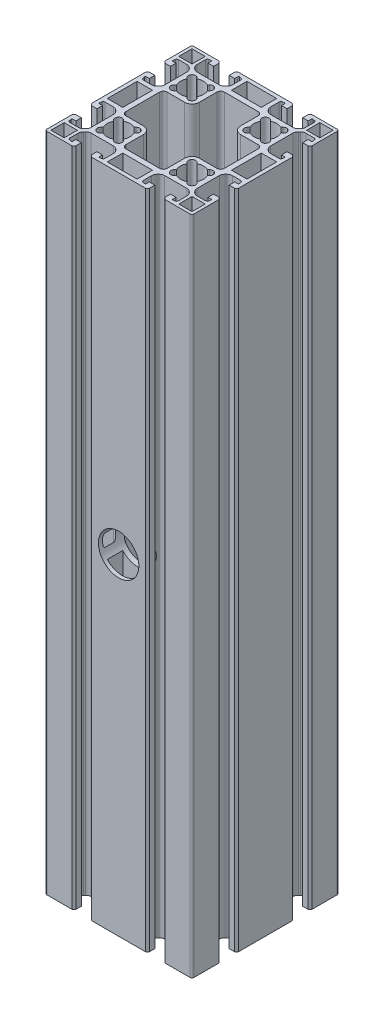
from build123d import *

# Parameters (mm, degrees)
SKETCH1_W           = 8.4
SKETCH1_H           = 16.2
SKETCH1_W_2         = 7.2
SKETCH1_H_2         = 7.2
SKETCH1_W_3         = 16.2
SKETCH1_H_3         = 8.4
BOSS_EXTRUDE1_DEPTH = 360
SKETCH3_R           = 11
CUT_EXTRUDE1_DEPTH  = 371.957573711


with BuildPart() as part:
    # Sketch1 → Boss-Extrude1 (new body)
    with BuildSketch(Plane(origin=(0, 0, 0), x_dir=(1, 0, 0), z_dir=(0, 1, 0))):
        with BuildLine():
            Line((39.881157874, -42.704615906), (39.881157874, -28.954615906))
            Line((39.881157874, -28.954615906), (38.881157874, -27.954615906))
            Line((38.881157874, -27.954615906), (35.881157874, -27.954615906))
            Line((35.881157874, -27.954615906), (35.881157874, -30.954615906))
            Line((35.881157874, -30.954615906), (37.485281077, -30.954615906))
            ThreePointArc((37.485281077, -30.954615906), (37.868303299, -31.133222101), (37.977684954, -31.541439995))
            Line((37.977684954, -31.541439995), (37.797926779, -32.560899266))
            ThreePointArc((37.797926779, -32.560899266), (37.49010865, -33.094055905), (36.911599801, -33.304615906))
            Line((36.911599801, -33.304615906), (32.215023493, -33.304615906))
            ThreePointArc((32.215023493, -33.304615906), (31.066973196, -33.076254504), (30.09370315, -32.42593625))
            Line((30.09370315, -32.42593625), (29.55983753, -31.89207063))
            ThreePointArc((29.55983753, -31.89207063), (28.909519276, -30.918800583), (28.681157874, -29.770750286))
            Line((28.681157874, -29.770750286), (28.681157874, -17.638481526))
            ThreePointArc((28.681157874, -17.638481526), (28.909519276, -16.490431229), (29.55983753, -15.517161182))
            Line((29.55983753, -15.517161182), (30.09370315, -14.983295562))
            ThreePointArc((30.09370315, -14.983295562), (31.066973196, -14.332977309), (32.215023493, -14.104615906))
            Line((32.215023493, -14.104615906), (36.911599801, -14.104615906))
            ThreePointArc((36.911599801, -14.104615906), (37.49010865, -14.315175907), (37.797926779, -14.848332546))
            Line((37.797926779, -14.848332546), (37.977684954, -15.867791817))
            ThreePointArc((37.977684954, -15.867791817), (37.868303299, -16.276009711), (37.485281077, -16.454615906))
            Line((37.485281077, -16.454615906), (35.881157874, -16.454615906))
            Line((35.881157874, -16.454615906), (35.881157874, -19.454615906))
            Line((35.881157874, -19.454615906), (38.881157874, -19.454615906))
            Line((38.881157874, -19.454615906), (39.881157874, -18.454615906))
            Line((39.881157874, -18.454615906), (39.881157874, 11.045384094))
            Line((39.881157874, 11.045384094), (38.881157874, 12.045384094))
            Line((38.881157874, 12.045384094), (35.881157874, 12.045384094))
            Line((35.881157874, 12.045384094), (35.881157874, 9.045384094))
            Line((35.881157874, 9.045384094), (37.485281077, 9.045384094))
            ThreePointArc((37.485281077, 9.045384094), (37.868303299, 8.866777899), (37.977684954, 8.458560005))
            Line((37.977684954, 8.458560005), (37.797926779, 7.439100734))
            ThreePointArc((37.797926779, 7.439100734), (37.49010865, 6.905944095), (36.911599801, 6.695384094))
            Line((36.911599801, 6.695384094), (32.215023493, 6.695384094))
            ThreePointArc((32.215023493, 6.695384094), (31.066973196, 6.923745496), (30.09370315, 7.57406375))
            Line((30.09370315, 7.57406375), (29.55983753, 8.10792937))
            ThreePointArc((29.55983753, 8.10792937), (28.909519276, 9.081199417), (28.681157874, 10.229249714))
            Line((28.681157874, 10.229249714), (28.681157874, 22.361518474))
            ThreePointArc((28.681157874, 22.361518474), (28.909519276, 23.509568771), (29.55983753, 24.482838818))
            Line((29.55983753, 24.482838818), (30.09370315, 25.016704438))
            ThreePointArc((30.09370315, 25.016704438), (31.066973196, 25.667022691), (32.215023493, 25.895384094))
            Line((32.215023493, 25.895384094), (36.911599801, 25.895384094))
            ThreePointArc((36.911599801, 25.895384094), (37.49010865, 25.684824093), (37.797926779, 25.151667454))
            Line((37.797926779, 25.151667454), (37.977684954, 24.132208183))
            ThreePointArc((37.977684954, 24.132208183), (37.868303299, 23.723990289), (37.485281077, 23.545384094))
            Line((37.485281077, 23.545384094), (35.881157874, 23.545384094))
            Line((35.881157874, 23.545384094), (35.881157874, 20.545384094))
            Line((35.881157874, 20.545384094), (38.881157874, 20.545384094))
            Line((38.881157874, 20.545384094), (39.881157874, 21.545384094))
            Line((39.881157874, 21.545384094), (39.881157874, 35.295384094))
            ThreePointArc((39.881157874, 35.295384094), (39.588264655, 36.002490875), (38.881157874, 36.295384094))
            Line((38.881157874, 36.295384094), (25.131157874, 36.295384094))
            Line((25.131157874, 36.295384094), (24.131157874, 35.295384094))
            Line((24.131157874, 35.295384094), (24.131157874, 32.295384094))
            Line((24.131157874, 32.295384094), (27.131157874, 32.295384094))
            Line((27.131157874, 32.295384094), (27.131157874, 33.899507298))
            ThreePointArc((27.131157874, 33.899507298), (27.309764069, 34.282529519), (27.717981962, 34.391911174))
            Line((27.717981962, 34.391911174), (28.737441233, 34.212152999))
            ThreePointArc((28.737441233, 34.212152999), (29.270597872, 33.90433487), (29.481157874, 33.325826021))
            Line((29.481157874, 33.325826021), (29.481157874, 28.629249714))
            ThreePointArc((29.481157874, 28.629249714), (29.252796471, 27.481199417), (28.602478217, 26.50792937))
            Line((28.602478217, 26.50792937), (28.068612597, 25.97406375))
            ThreePointArc((28.068612597, 25.97406375), (27.095342551, 25.323745496), (25.947292254, 25.095384094))
            Line((25.947292254, 25.095384094), (13.815023493, 25.095384094))
            ThreePointArc((13.815023493, 25.095384094), (12.666973196, 25.323745496), (11.69370315, 25.97406375))
            Line((11.69370315, 25.97406375), (11.15983753, 26.50792937))
            ThreePointArc((11.15983753, 26.50792937), (10.509519276, 27.481199417), (10.281157874, 28.629249714))
            Line((10.281157874, 28.629249714), (10.281157874, 33.325826021))
            ThreePointArc((10.281157874, 33.325826021), (10.491717875, 33.90433487), (11.024874514, 34.212152999))
            Line((11.024874514, 34.212152999), (12.044333785, 34.391911174))
            ThreePointArc((12.044333785, 34.391911174), (12.452551678, 34.282529519), (12.631157874, 33.899507298))
            Line((12.631157874, 33.899507298), (12.631157874, 32.295384094))
            Line((12.631157874, 32.295384094), (15.631157874, 32.295384094))
            Line((15.631157874, 32.295384094), (15.631157874, 35.295384094))
            Line((15.631157874, 35.295384094), (14.631157874, 36.295384094))
            Line((14.631157874, 36.295384094), (-14.868842126, 36.295384094))
            Line((-14.868842126, 36.295384094), (-15.868842126, 35.295384094))
            Line((-15.868842126, 35.295384094), (-15.868842126, 32.295384094))
            Line((-15.868842126, 32.295384094), (-12.868842126, 32.295384094))
            Line((-12.868842126, 32.295384094), (-12.868842126, 33.899507298))
            ThreePointArc((-12.868842126, 33.899507298), (-12.690235931, 34.282529519), (-12.282018038, 34.391911174))
            Line((-12.282018038, 34.391911174), (-11.262558767, 34.212152999))
            ThreePointArc((-11.262558767, 34.212152999), (-10.729402128, 33.90433487), (-10.518842126, 33.325826021))
            Line((-10.518842126, 33.325826021), (-10.518842126, 28.629249714))
            ThreePointArc((-10.518842126, 28.629249714), (-10.747203529, 27.481199417), (-11.397521783, 26.50792937))
            Line((-11.397521783, 26.50792937), (-11.931387403, 25.97406375))
            ThreePointArc((-11.931387403, 25.97406375), (-12.904657449, 25.323745496), (-14.052707746, 25.095384094))
            Line((-14.052707746, 25.095384094), (-26.184976507, 25.095384094))
            ThreePointArc((-26.184976507, 25.095384094), (-27.333026804, 25.323745496), (-28.30629685, 25.97406375))
            Line((-28.30629685, 25.97406375), (-28.84016247, 26.50792937))
            ThreePointArc((-28.84016247, 26.50792937), (-29.490480724, 27.481199417), (-29.718842126, 28.629249714))
            Line((-29.718842126, 28.629249714), (-29.718842126, 33.325826021))
            ThreePointArc((-29.718842126, 33.325826021), (-29.508282125, 33.90433487), (-28.975125486, 34.212152999))
            Line((-28.975125486, 34.212152999), (-27.955666215, 34.391911174))
            ThreePointArc((-27.955666215, 34.391911174), (-27.547448322, 34.282529519), (-27.368842126, 33.899507298))
            Line((-27.368842126, 33.899507298), (-27.368842126, 32.295384094))
            Line((-27.368842126, 32.295384094), (-24.368842126, 32.295384094))
            Line((-24.368842126, 32.295384094), (-24.368842126, 35.295384094))
            Line((-24.368842126, 35.295384094), (-25.368842126, 36.295384094))
            Line((-25.368842126, 36.295384094), (-39.118842126, 36.295384094))
            ThreePointArc((-39.118842126, 36.295384094), (-39.825948908, 36.002490875), (-40.118842126, 35.295384094))
            Line((-40.118842126, 35.295384094), (-40.118842126, 21.545384094))
            Line((-40.118842126, 21.545384094), (-39.118842126, 20.545384094))
            Line((-39.118842126, 20.545384094), (-36.118842126, 20.545384094))
            Line((-36.118842126, 20.545384094), (-36.118842126, 23.545384094))
            Line((-36.118842126, 23.545384094), (-37.72296533, 23.545384094))
            ThreePointArc((-37.72296533, 23.545384094), (-38.105987552, 23.723990289), (-38.215369207, 24.132208183))
            Line((-38.215369207, 24.132208183), (-38.035611031, 25.151667454))
            ThreePointArc((-38.035611031, 25.151667454), (-37.727792902, 25.684824093), (-37.149284054, 25.895384094))
            Line((-37.149284054, 25.895384094), (-32.452707746, 25.895384094))
            ThreePointArc((-32.452707746, 25.895384094), (-31.304657449, 25.667022691), (-30.331387403, 25.016704438))
            Line((-30.331387403, 25.016704438), (-29.797521783, 24.482838818))
            ThreePointArc((-29.797521783, 24.482838818), (-29.147203529, 23.509568771), (-28.918842126, 22.361518474))
            Line((-28.918842126, 22.361518474), (-28.918842126, 10.229249714))
            ThreePointArc((-28.918842126, 10.229249714), (-29.147203529, 9.081199417), (-29.797521783, 8.10792937))
            Line((-29.797521783, 8.10792937), (-30.331387403, 7.57406375))
            ThreePointArc((-30.331387403, 7.57406375), (-31.304657449, 6.923745496), (-32.452707746, 6.695384094))
            Line((-32.452707746, 6.695384094), (-37.149284054, 6.695384094))
            ThreePointArc((-37.149284054, 6.695384094), (-37.727792902, 6.905944095), (-38.035611031, 7.439100734))
            Line((-38.035611031, 7.439100734), (-38.215369207, 8.458560005))
            ThreePointArc((-38.215369207, 8.458560005), (-38.105987552, 8.866777899), (-37.72296533, 9.045384094))
            Line((-37.72296533, 9.045384094), (-36.118842126, 9.045384094))
            Line((-36.118842126, 9.045384094), (-36.118842126, 12.045384094))
            Line((-36.118842126, 12.045384094), (-39.118842126, 12.045384094))
            Line((-39.118842126, 12.045384094), (-40.118842126, 11.045384094))
            Line((-40.118842126, 11.045384094), (-40.118842126, -18.454615906))
            Line((-40.118842126, -18.454615906), (-39.118842126, -19.454615906))
            Line((-39.118842126, -19.454615906), (-36.118842126, -19.454615906))
            Line((-36.118842126, -19.454615906), (-36.118842126, -16.454615906))
            Line((-36.118842126, -16.454615906), (-37.72296533, -16.454615906))
            ThreePointArc((-37.72296533, -16.454615906), (-38.105987552, -16.276009711), (-38.215369207, -15.867791817))
            Line((-38.215369207, -15.867791817), (-38.035611031, -14.848332546))
            ThreePointArc((-38.035611031, -14.848332546), (-37.727792902, -14.315175907), (-37.149284054, -14.104615906))
            Line((-37.149284054, -14.104615906), (-32.452707746, -14.104615906))
            ThreePointArc((-32.452707746, -14.104615906), (-31.304657449, -14.332977309), (-30.331387403, -14.983295562))
            Line((-30.331387403, -14.983295562), (-29.797521783, -15.517161182))
            ThreePointArc((-29.797521783, -15.517161182), (-29.147203529, -16.490431229), (-28.918842126, -17.638481526))
            Line((-28.918842126, -17.638481526), (-28.918842126, -29.770750286))
            ThreePointArc((-28.918842126, -29.770750286), (-29.147203529, -30.918800583), (-29.797521783, -31.89207063))
            Line((-29.797521783, -31.89207063), (-30.331387403, -32.42593625))
            ThreePointArc((-30.331387403, -32.42593625), (-31.304657449, -33.076254504), (-32.452707746, -33.304615906))
            Line((-32.452707746, -33.304615906), (-37.149284054, -33.304615906))
            ThreePointArc((-37.149284054, -33.304615906), (-37.727792902, -33.094055905), (-38.035611031, -32.560899266))
            Line((-38.035611031, -32.560899266), (-38.215369207, -31.541439995))
            ThreePointArc((-38.215369207, -31.541439995), (-38.105987552, -31.133222101), (-37.72296533, -30.954615906))
            Line((-37.72296533, -30.954615906), (-36.118842126, -30.954615906))
            Line((-36.118842126, -30.954615906), (-36.118842126, -27.954615906))
            Line((-36.118842126, -27.954615906), (-39.118842126, -27.954615906))
            Line((-39.118842126, -27.954615906), (-40.118842126, -28.954615906))
            Line((-40.118842126, -28.954615906), (-40.118842126, -42.704615906))
            ThreePointArc((-40.118842126, -42.704615906), (-39.825948908, -43.411722687), (-39.118842126, -43.704615906))
            Line((-39.118842126, -43.704615906), (-25.368842126, -43.704615906))
            Line((-25.368842126, -43.704615906), (-24.368842126, -42.704615906))
            Line((-24.368842126, -42.704615906), (-24.368842126, -39.704615906))
            Line((-24.368842126, -39.704615906), (-27.368842126, -39.704615906))
            Line((-27.368842126, -39.704615906), (-27.368842126, -41.30873911))
            ThreePointArc((-27.368842126, -41.30873911), (-27.547448322, -41.691761331), (-27.955666215, -41.801142986))
            Line((-27.955666215, -41.801142986), (-28.975125486, -41.621384811))
            ThreePointArc((-28.975125486, -41.621384811), (-29.508282125, -41.313566682), (-29.718842126, -40.735057833))
            Line((-29.718842126, -40.735057833), (-29.718842126, -36.038481526))
            ThreePointArc((-29.718842126, -36.038481526), (-29.490480724, -34.890431229), (-28.84016247, -33.917161182))
            Line((-28.84016247, -33.917161182), (-28.30629685, -33.383295562))
            ThreePointArc((-28.30629685, -33.383295562), (-27.333026804, -32.732977309), (-26.184976507, -32.504615906))
            Line((-26.184976507, -32.504615906), (-14.052707746, -32.504615906))
            ThreePointArc((-14.052707746, -32.504615906), (-12.904657449, -32.732977309), (-11.931387403, -33.383295562))
            Line((-11.931387403, -33.383295562), (-11.397521783, -33.917161182))
            ThreePointArc((-11.397521783, -33.917161182), (-10.747203529, -34.890431229), (-10.518842126, -36.038481526))
            Line((-10.518842126, -36.038481526), (-10.518842126, -40.735057833))
            ThreePointArc((-10.518842126, -40.735057833), (-10.729402128, -41.313566682), (-11.262558767, -41.621384811))
            Line((-11.262558767, -41.621384811), (-12.282018038, -41.801142986))
            ThreePointArc((-12.282018038, -41.801142986), (-12.690235931, -41.691761331), (-12.868842126, -41.30873911))
            Line((-12.868842126, -41.30873911), (-12.868842126, -39.704615906))
            Line((-12.868842126, -39.704615906), (-15.868842126, -39.704615906))
            Line((-15.868842126, -39.704615906), (-15.868842126, -42.704615906))
            Line((-15.868842126, -42.704615906), (-14.868842126, -43.704615906))
            Line((-14.868842126, -43.704615906), (14.631157874, -43.704615906))
            Line((14.631157874, -43.704615906), (15.631157874, -42.704615906))
            Line((15.631157874, -42.704615906), (15.631157874, -39.704615906))
            Line((15.631157874, -39.704615906), (12.631157874, -39.704615906))
            Line((12.631157874, -39.704615906), (12.631157874, -41.30873911))
            ThreePointArc((12.631157874, -41.30873911), (12.452551678, -41.691761331), (12.044333785, -41.801142986))
            Line((12.044333785, -41.801142986), (11.024874514, -41.621384811))
            ThreePointArc((11.024874514, -41.621384811), (10.491717875, -41.313566682), (10.281157874, -40.735057833))
            Line((10.281157874, -40.735057833), (10.281157874, -36.038481526))
            ThreePointArc((10.281157874, -36.038481526), (10.509519276, -34.890431229), (11.15983753, -33.917161182))
            Line((11.15983753, -33.917161182), (11.69370315, -33.383295562))
            ThreePointArc((11.69370315, -33.383295562), (12.666973196, -32.732977309), (13.815023493, -32.504615906))
            Line((13.815023493, -32.504615906), (25.947292254, -32.504615906))
            ThreePointArc((25.947292254, -32.504615906), (27.095342551, -32.732977309), (28.068612597, -33.383295562))
            Line((28.068612597, -33.383295562), (28.602478217, -33.917161182))
            ThreePointArc((28.602478217, -33.917161182), (29.252796471, -34.890431229), (29.481157874, -36.038481526))
            Line((29.481157874, -36.038481526), (29.481157874, -40.735057833))
            ThreePointArc((29.481157874, -40.735057833), (29.270597872, -41.313566682), (28.737441233, -41.621384811))
            Line((28.737441233, -41.621384811), (27.717981962, -41.801142986))
            ThreePointArc((27.717981962, -41.801142986), (27.309764069, -41.691761331), (27.131157874, -41.30873911))
            Line((27.131157874, -41.30873911), (27.131157874, -39.704615906))
            Line((27.131157874, -39.704615906), (24.131157874, -39.704615906))
            Line((24.131157874, -39.704615906), (24.131157874, -42.704615906))
            Line((24.131157874, -42.704615906), (25.131157874, -43.704615906))
            Line((25.131157874, -43.704615906), (38.881157874, -43.704615906))
            ThreePointArc((38.881157874, -43.704615906), (39.588264655, -43.411722687), (39.881157874, -42.704615906))
        make_face()
        with BuildLine():
            Line((16.522400663, 10.108199759), (17.10833788, 10.694136975))
            ThreePointArc((17.10833788, 10.694136975), (19.881157874, 10.045384094), (22.653977867, 10.694136975))
            Line((22.653977867, 10.694136975), (23.239915084, 10.108199759))
            ThreePointArc((23.239915084, 10.108199759), (26.068342209, 10.108199759), (26.068342209, 12.936626883))
            Line((26.068342209, 12.936626883), (25.482404992, 13.5225641))
            ThreePointArc((25.482404992, 13.5225641), (26.131157874, 16.295384094), (25.482404992, 19.068204088))
            Line((25.482404992, 19.068204088), (26.068342209, 19.654141305))
            ThreePointArc((26.068342209, 19.654141305), (26.068342209, 22.482568429), (23.239915084, 22.482568429))
            Line((23.239915084, 22.482568429), (22.653977867, 21.896631212))
            ThreePointArc((22.653977867, 21.896631212), (19.881157874, 22.545384094), (17.10833788, 21.896631212))
            Line((17.10833788, 21.896631212), (16.522400663, 22.482568429))
            ThreePointArc((16.522400663, 22.482568429), (13.693973538, 22.482568429), (13.693973538, 19.654141305))
            Line((13.693973538, 19.654141305), (14.279910755, 19.068204088))
            ThreePointArc((14.279910755, 19.068204088), (13.631157874, 16.295384094), (14.279910755, 13.5225641))
            Line((14.279910755, 13.5225641), (13.693973538, 12.936626883))
            ThreePointArc((13.693973538, 12.936626883), (13.693973538, 10.108199759), (16.522400663, 10.108199759))
        make_face(mode=Mode.SUBTRACT)
        with Locations((-33.918842126, -3.704615906)):
            Rectangle(SKETCH1_W, SKETCH1_H, mode=Mode.SUBTRACT)
        with BuildLine():
            Line((-23.477599337, 10.108199759), (-22.89166212, 10.694136975))
            ThreePointArc((-22.89166212, 10.694136975), (-20.118842126, 10.045384094), (-17.346022133, 10.694136975))
            Line((-17.346022133, 10.694136975), (-16.760084916, 10.108199759))
            ThreePointArc((-16.760084916, 10.108199759), (-13.931657791, 10.108199759), (-13.931657791, 12.936626883))
            Line((-13.931657791, 12.936626883), (-14.517595008, 13.5225641))
            ThreePointArc((-14.517595008, 13.5225641), (-13.868842126, 16.295384094), (-14.517595008, 19.068204088))
            Line((-14.517595008, 19.068204088), (-13.931657791, 19.654141305))
            ThreePointArc((-13.931657791, 19.654141305), (-13.931657791, 22.482568429), (-16.760084916, 22.482568429))
            Line((-16.760084916, 22.482568429), (-17.346022133, 21.896631212))
            ThreePointArc((-17.346022133, 21.896631212), (-20.118842126, 22.545384094), (-22.89166212, 21.896631212))
            Line((-22.89166212, 21.896631212), (-23.477599337, 22.482568429))
            ThreePointArc((-23.477599337, 22.482568429), (-26.306026462, 22.482568429), (-26.306026462, 19.654141305))
            Line((-26.306026462, 19.654141305), (-25.720089245, 19.068204088))
            ThreePointArc((-25.720089245, 19.068204088), (-26.368842126, 16.295384094), (-25.720089245, 13.5225641))
            Line((-25.720089245, 13.5225641), (-26.306026462, 12.936626883))
            ThreePointArc((-26.306026462, 12.936626883), (-26.306026462, 10.108199759), (-23.477599337, 10.108199759))
        make_face(mode=Mode.SUBTRACT)
        with BuildLine():
            Line((23.239915084, -17.517431571), (22.653977867, -18.103368788))
            ThreePointArc((22.653977867, -18.103368788), (19.881157874, -17.454615906), (17.10833788, -18.103368788))
            Line((17.10833788, -18.103368788), (16.522400663, -17.517431571))
            ThreePointArc((16.522400663, -17.517431571), (13.693973538, -17.517431571), (13.693973538, -20.345858695))
            Line((13.693973538, -20.345858695), (14.279910755, -20.931795912))
            ThreePointArc((14.279910755, -20.931795912), (13.631157874, -23.704615906), (14.279910755, -26.4774359))
            Line((14.279910755, -26.4774359), (13.693973538, -27.063373117))
            ThreePointArc((13.693973538, -27.063373117), (13.693973538, -29.891800241), (16.522400663, -29.891800241))
            Line((16.522400663, -29.891800241), (17.10833788, -29.305863025))
            ThreePointArc((17.10833788, -29.305863025), (19.881157874, -29.954615906), (22.653977867, -29.305863025))
            Line((22.653977867, -29.305863025), (23.239915084, -29.891800241))
            ThreePointArc((23.239915084, -29.891800241), (26.068342209, -29.891800241), (26.068342209, -27.063373117))
            Line((26.068342209, -27.063373117), (25.482404992, -26.4774359))
            ThreePointArc((25.482404992, -26.4774359), (26.131157874, -23.704615906), (25.482404992, -20.931795912))
            Line((25.482404992, -20.931795912), (26.068342209, -20.345858695))
            ThreePointArc((26.068342209, -20.345858695), (26.068342209, -17.517431571), (23.239915084, -17.517431571))
        make_face(mode=Mode.SUBTRACT)
        with Locations((-34.918842126, -38.504615906)):
            Rectangle(SKETCH1_W_2, SKETCH1_H_2, mode=Mode.SUBTRACT)
        with BuildLine():
            Line((-16.760084916, -17.517431571), (-17.346022133, -18.103368788))
            ThreePointArc((-17.346022133, -18.103368788), (-20.118842126, -17.454615906), (-22.89166212, -18.103368788))
            Line((-22.89166212, -18.103368788), (-23.477599337, -17.517431571))
            ThreePointArc((-23.477599337, -17.517431571), (-26.306026462, -17.517431571), (-26.306026462, -20.345858695))
            Line((-26.306026462, -20.345858695), (-25.720089245, -20.931795912))
            ThreePointArc((-25.720089245, -20.931795912), (-26.368842126, -23.704615906), (-25.720089245, -26.4774359))
            Line((-25.720089245, -26.4774359), (-26.306026462, -27.063373117))
            ThreePointArc((-26.306026462, -27.063373117), (-26.306026462, -29.891800241), (-23.477599337, -29.891800241))
            Line((-23.477599337, -29.891800241), (-22.89166212, -29.305863025))
            ThreePointArc((-22.89166212, -29.305863025), (-20.118842126, -29.954615906), (-17.346022133, -29.305863025))
            Line((-17.346022133, -29.305863025), (-16.760084916, -29.891800241))
            ThreePointArc((-16.760084916, -29.891800241), (-13.931657791, -29.891800241), (-13.931657791, -27.063373117))
            Line((-13.931657791, -27.063373117), (-14.517595008, -26.4774359))
            ThreePointArc((-14.517595008, -26.4774359), (-13.868842126, -23.704615906), (-14.517595008, -20.931795912))
            Line((-14.517595008, -20.931795912), (-13.931657791, -20.345858695))
            ThreePointArc((-13.931657791, -20.345858695), (-13.931657791, -17.517431571), (-16.760084916, -17.517431571))
        make_face(mode=Mode.SUBTRACT)
        with Locations((-34.918842126, 31.095384094)):
            Rectangle(SKETCH1_W_2, SKETCH1_H_2, mode=Mode.SUBTRACT)
        with Locations((34.681157874, -38.504615906)):
            Rectangle(SKETCH1_W_2, SKETCH1_H_2, mode=Mode.SUBTRACT)
        with Locations((34.681157874, 31.095384094)):
            Rectangle(SKETCH1_W_2, SKETCH1_H_2, mode=Mode.SUBTRACT)
        with Locations((-0.118842126, 30.095384094)):
            Rectangle(SKETCH1_W_3, SKETCH1_H_3, mode=Mode.SUBTRACT)
        with BuildLine():
            Line((11.081157874, -28.504615906), (11.081157874, -18.904615906))
            ThreePointArc((11.081157874, -18.904615906), (12.252730749, -16.076188781), (15.081157874, -14.904615906))
            Line((15.081157874, -14.904615906), (24.681157874, -14.904615906))
            ThreePointArc((24.681157874, -14.904615906), (26.095371436, -14.318829468), (26.681157874, -12.904615906))
            Line((26.681157874, -12.904615906), (26.681157874, 5.495384094))
            ThreePointArc((26.681157874, 5.495384094), (26.095371436, 6.909597656), (24.681157874, 7.495384094))
            Line((24.681157874, 7.495384094), (15.081157874, 7.495384094))
            ThreePointArc((15.081157874, 7.495384094), (12.252730749, 8.666956969), (11.081157874, 11.495384094))
            Line((11.081157874, 11.495384094), (11.081157874, 21.095384094))
            ThreePointArc((11.081157874, 21.095384094), (10.495371436, 22.509597656), (9.081157874, 23.095384094))
            Line((9.081157874, 23.095384094), (-9.318842126, 23.095384094))
            ThreePointArc((-9.318842126, 23.095384094), (-10.733055689, 22.509597656), (-11.318842126, 21.095384094))
            Line((-11.318842126, 21.095384094), (-11.318842126, 11.495384094))
            ThreePointArc((-11.318842126, 11.495384094), (-12.490415002, 8.666956969), (-15.318842126, 7.495384094))
            Line((-15.318842126, 7.495384094), (-24.918842126, 7.495384094))
            ThreePointArc((-24.918842126, 7.495384094), (-26.333055689, 6.909597656), (-26.918842126, 5.495384094))
            Line((-26.918842126, 5.495384094), (-26.918842126, -12.904615906))
            ThreePointArc((-26.918842126, -12.904615906), (-26.333055689, -14.318829468), (-24.918842126, -14.904615906))
            Line((-24.918842126, -14.904615906), (-15.318842126, -14.904615906))
            ThreePointArc((-15.318842126, -14.904615906), (-12.490415002, -16.076188781), (-11.318842126, -18.904615906))
            Line((-11.318842126, -18.904615906), (-11.318842126, -28.504615906))
            ThreePointArc((-11.318842126, -28.504615906), (-10.733055689, -29.918829468), (-9.318842126, -30.504615906))
            Line((-9.318842126, -30.504615906), (9.081157874, -30.504615906))
            ThreePointArc((9.081157874, -30.504615906), (10.495371436, -29.918829468), (11.081157874, -28.504615906))
        make_face(mode=Mode.SUBTRACT)
        with Locations((-0.118842126, -37.504615906)):
            Rectangle(SKETCH1_W_3, SKETCH1_H_3, mode=Mode.SUBTRACT)
        with Locations((33.681157874, -3.704615906)):
            Rectangle(SKETCH1_W, SKETCH1_H, mode=Mode.SUBTRACT)
    extrude(amount=BOSS_EXTRUDE1_DEPTH)

    # Sketch3 → Cut-Extrude1 (cut, through all)
    with BuildSketch(Plane(origin=(0, 0, -36.295384094), x_dir=(-1, 0, 0), z_dir=(0, 0, -1))):
        with Locations((0.059421063, 180)):
            Circle(SKETCH3_R)
    extrude(amount=-CUT_EXTRUDE1_DEPTH, mode=Mode.SUBTRACT)


solid = part.part
